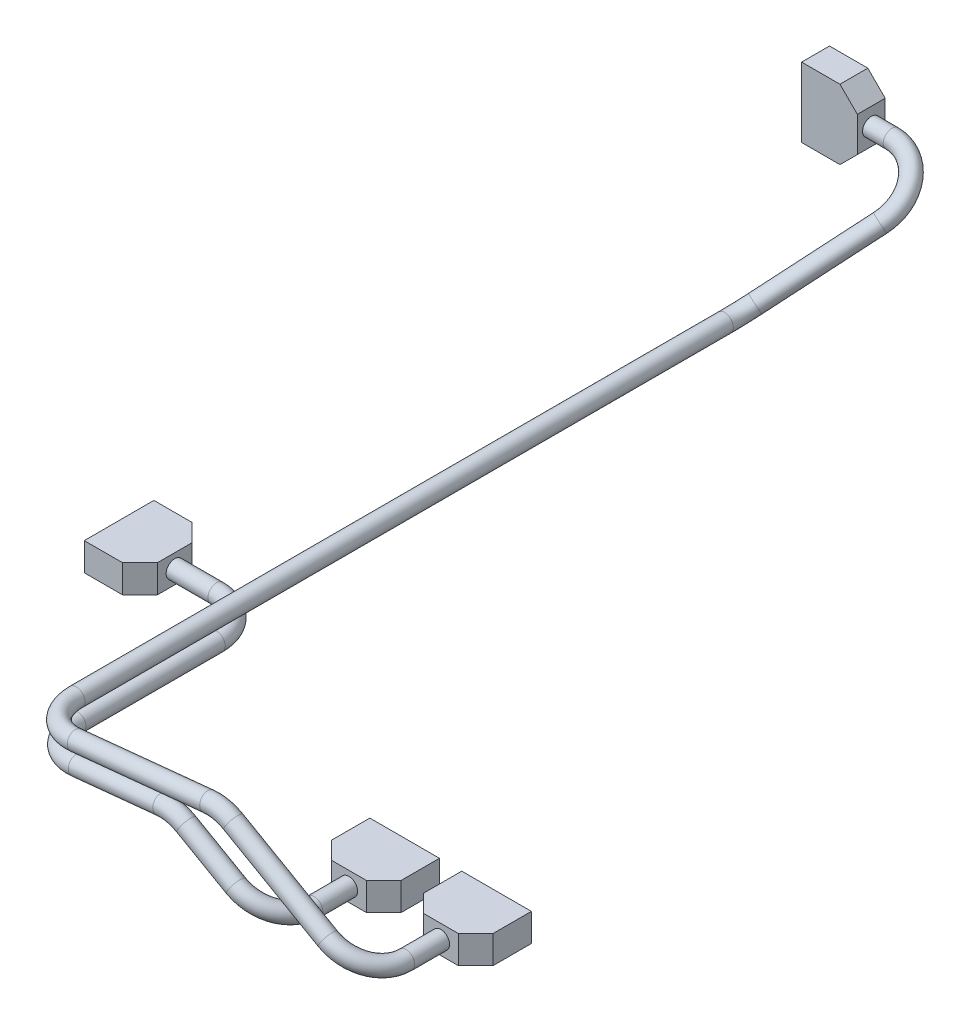
from build123d import *

# Parameters (mm, degrees)
BOSS_EXTRUDE1_DEPTH = 6.35
BOSS_EXTRUDE2_DEPTH = 6.35
SKETCH4_R           = 3.9751
BOSS_EXTRUDE3_DEPTH = 6.35
BOSS_EXTRUDE4_DEPTH = 6.35
SKETCH9_R           = 3.9751


with BuildPart() as part:
    # Sketch1 → Boss-Extrude1 (new, symmetric)
    with BuildSketch(Plane(origin=(0, -203.2, 0), x_dir=(-1, 0, 0), z_dir=(0, 1, 0))):
        Polygon((-19.05, -212.725), (-19.05, -244.475), (-36.5252, -244.475), (-44.45, -236.5502), (-44.45, -220.6498), (-36.5252, -212.725), align=None)
    extrude(amount=BOSS_EXTRUDE1_DEPTH, both=True)



with BuildPart() as body_2:
    # Sketch2 → Boss-Extrude2 (new, symmetric)
    with BuildSketch(Plane(origin=(0, -222.25, 0), x_dir=(-1, 0, 0), z_dir=(0, 1, 0))):
        Polygon((-174.625, -187.325), (-206.375, -187.325), (-206.375, -169.8498), (-198.4502, -161.925), (-182.5498, -161.925), (-174.625, -169.8498), align=None)
    extrude(amount=BOSS_EXTRUDE2_DEPTH, both=True)


with BuildPart() as part_1:
    add(part.part)

    add(body_2.part)  # Sweep1 merges body 2
    # Sweep1: sweep along a curve in space
    with BuildLine() as sweep1_path:
        Line((44.45, -203.2, -228.6), (63.5, -203.2, -228.6))
        ThreePointArc((63.5, -203.2, -228.6), (76.970384182, -203.2, -223.020384182), (82.55, -203.2, -209.55))
        Line((82.55, -203.2, -209.55), (82.55, -203.2, -146.05))
        ThreePointArc((82.55, -203.2, -146.05), (88.101925246, -202.644807475, -132.579615818), (101.505458474, -201.304454153, -127))
        Line((101.505458474, -201.304454153, -127), (139.990428898, -197.45595711, -127))
        ThreePointArc((139.990428898, -197.45595711, -127), (145.852267869, -197.778889752, -127), (151.337421521, -199.871383726, -127))
        Line((151.337421521, -199.871383726, -127), (173.959968143, -212.798553224, -127))
        ThreePointArc((173.959968143, -212.798553224, -127), (185.65553683, -219.481735331, -132.579615818), (190.5, -222.25, -146.05))
        Line((190.5, -222.25, -146.05), (190.5, -222.25, -161.925))
    # Sketch4 → Sweep1 (sweep)
    with BuildSketch(Plane(origin=(44.45, 0, 0), x_dir=(0, 0, -1), z_dir=(1, 0, 0))):
        with Locations((228.6, -203.2)):
            Circle(SKETCH4_R)
    sweep(path=sweep1_path.line)


with BuildPart() as body_2_2:
    # Sketch5 → Boss-Extrude3 (new, symmetric)
    with BuildSketch(Plane.XY.offset(-514.35)):
        Polygon((50.8, -139.7), (50.8, -171.45), (68.2752, -171.45), (76.2, -163.5252), (76.2, -147.6248), (68.2752, -139.7), align=None)
    extrude(amount=BOSS_EXTRUDE3_DEPTH, both=True)



with BuildPart() as body_3:
    # Sketch6 → Boss-Extrude4 (new, symmetric)
    with BuildSketch(Plane(origin=(0, -222.25, 0), x_dir=(-1, 0, 0), z_dir=(0, 1, 0))):
        Polygon((-216.535, -187.325), (-248.285, -187.325), (-248.285, -169.8498), (-240.3602, -161.925), (-224.4598, -161.925), (-216.535, -169.8498), align=None)
    extrude(amount=BOSS_EXTRUDE4_DEPTH, both=True)


with BuildPart() as body_2_2_1:
    add(body_2_2.part)

    add(body_3.part)  # Sweep2 merges body 3
    # Sweep2: sweep along a curve in space
    with BuildLine() as sweep2_path:
        Line((76.2, -155.575, -514.35), (85.606319265, -155.575, -514.35))
        ThreePointArc((85.606319265, -155.575, -514.35), (101.477046373, -159.814117394, -506.967197178), (103.162796684, -168.742620996, -491.417408046))
        Line((103.162796684, -168.742620996, -491.417408046), (84.544962074, -190.754663245, -453.081463906))
        ThreePointArc((84.544962074, -190.754663245, -453.081463906), (82.708769779, -192.925610792, -447.667563479), (82.074934709, -193.675, -441.631703793))
        Line((82.074934709, -193.675, -441.631703793), (82.074934709, -193.675, -146.05))
        ThreePointArc((82.074934709, -193.675, -146.05), (87.626859955, -193.119807475, -132.579615818), (101.030393182, -191.779454153, -127))
        Line((101.030393182, -191.779454153, -127), (161.401589386, -185.742334532, -127))
        ThreePointArc((161.401589386, -185.742334532, -127), (167.263428358, -186.065267174, -127), (172.748582009, -188.157761148, -127))
        Line((172.748582009, -188.157761148, -127), (215.869968143, -212.798553224, -127))
        ThreePointArc((215.869968143, -212.798553224, -127), (227.56553683, -219.481735331, -132.579615818), (232.41, -222.25, -146.05))
        Line((232.41, -222.25, -146.05), (232.41, -222.25, -161.925))
    # Sketch9 → Sweep2 (sweep)
    with BuildSketch(Plane(origin=(76.2, 0, 0), x_dir=(0, 0, -1), z_dir=(1, 0, 0))):
        with Locations((514.35, -155.575)):
            Circle(SKETCH9_R)
    sweep(path=sweep2_path.line)


solid = Compound([part_1.part, body_2_2_1.part])
